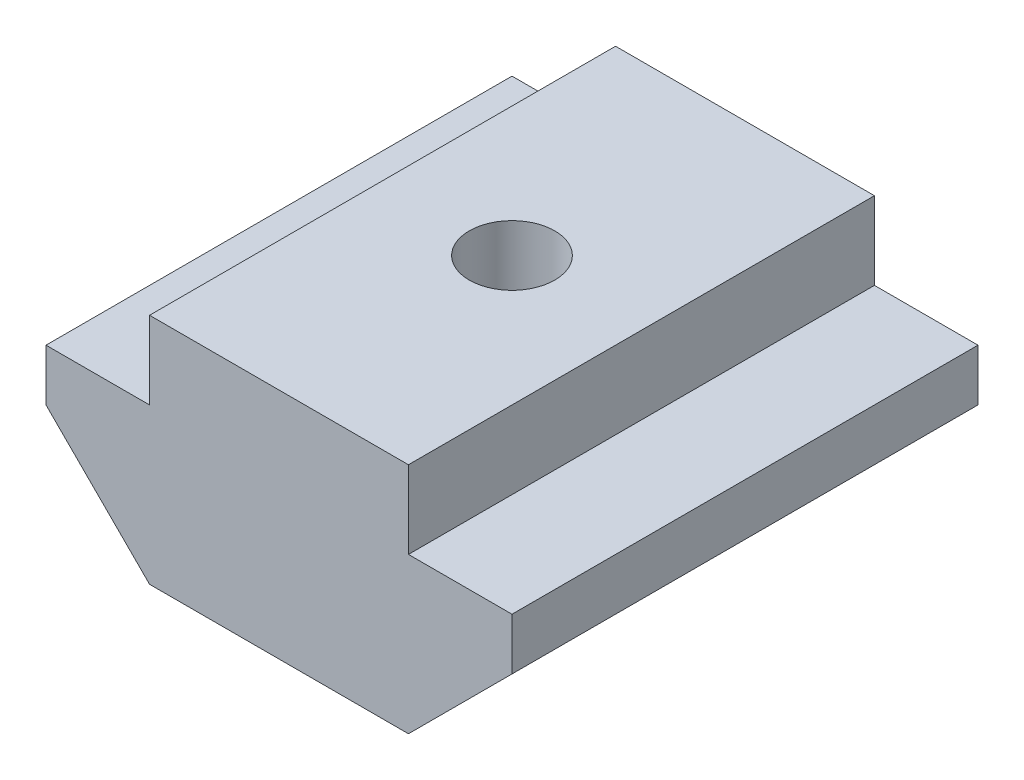
from build123d import *

# Parameters (mm, degrees)
EXTRUDE_1_DEPTH    = 18
HOLE_WIZARD_M4_1_D = 3.3


with BuildPart() as part:
    # 草图1 → 拉伸1 (new body)
    with BuildSketch(Plane.XY):
        Polygon((0, 0), (4, 0), (4, 3), (14, 3), (14, 0), (18, 0), (18, -2), (14, -6), (4, -6), (0, -2), align=None)
    extrude(amount=EXTRUDE_1_DEPTH)

    # M4 螺纹孔1 (through all)
    with Locations(Plane(origin=(9, 3, 9), x_dir=(0, 0, 1), z_dir=(0, 1, 0))):
        with Locations((0, 0)):
            Hole(HOLE_WIZARD_M4_1_D / 2)


solid = part.part
